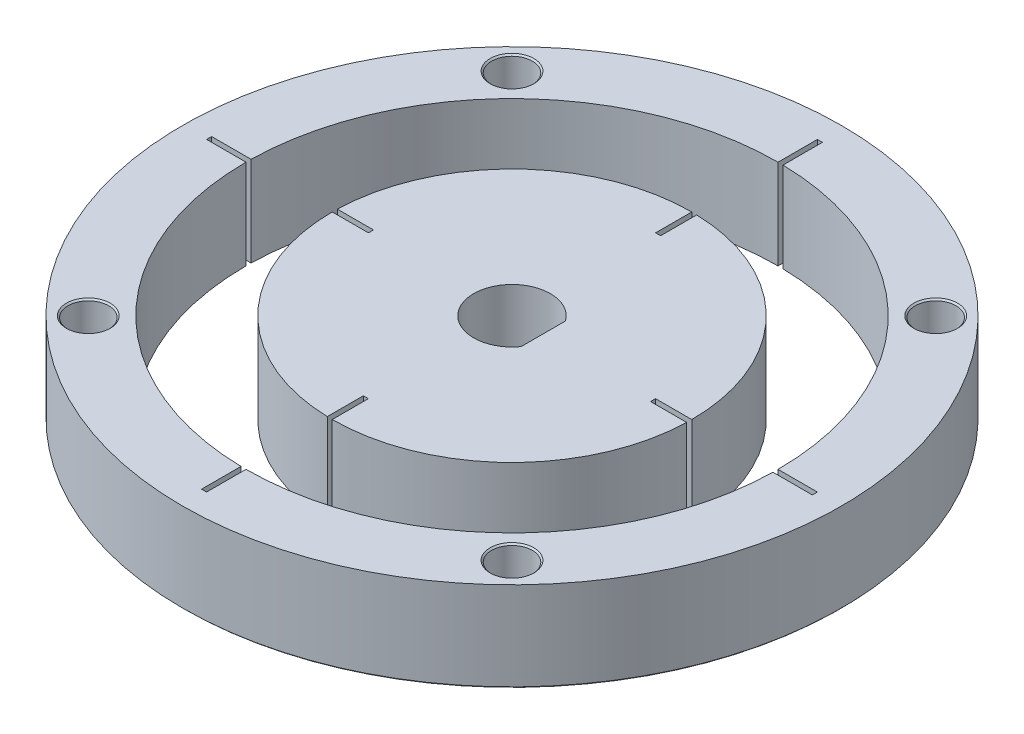
from build123d import *

# Parameters (mm, degrees)
SKETCH2_R             = 27.5
SKETCH2_R_2           = 22.197520882
BOSS_EXTRUDE3_DEPTH   = 7.5
BOSS_EXTRUDE3_2_DEPTH = 7.5
SKETCH5_R             = 1.7
SKETCH5_W             = 0.42
SKETCH5_H             = 13.5
SKETCH5_W_2           = 13.5
SKETCH5_H_2           = 0.42
CUT_EXTRUDE6_DEPTH    = 40.607448794
CUT_EXTRUDE8_DEPTH    = 7.5
CHAMFER3_SIZE         = 0.125
CHAMFER4_SIZE         = 0.125


with BuildPart() as part:
    # Sketch2 → Boss-Extrude3 (new body)
    with BuildSketch(Plane(origin=(0, 0, 0), x_dir=(1, 0, 0), z_dir=(0, 1, 0))):
        with Locations(Location((0, 0, 0), (0, 0, 270))):
            Circle(SKETCH2_R)
        with Locations(Location((0, 0, 0), (0, 0, 270))):
            Circle(SKETCH2_R_2, mode=Mode.SUBTRACT)
    extrude(amount=BOSS_EXTRUDE3_DEPTH)

    # Sketch5 → Cut-Extrude6 (cut, through all)
    with BuildSketch(Plane.XZ):
        with Locations(Location((-17.67766953, 17.67766953, 0), (0, 0, 270))):
            Circle(SKETCH5_R)
        with Locations(Location((17.67766953, 17.67766953, 0), (0, 0, 270))):
            Circle(SKETCH5_R)
        with Locations(Location((17.67766953, -17.67766953, 0), (0, 0, 270))):
            Circle(SKETCH5_R)
        with Locations(Location((-17.67766953, -17.67766953, 0), (0, 0, 270))):
            Circle(SKETCH5_R)
        with Locations((0.21, -18.733167206)):
            Rectangle(SKETCH5_W, SKETCH5_H)
        with Locations((-18.733167206, -0.21)):
            Rectangle(SKETCH5_W_2, SKETCH5_H_2)
        with Locations((-0.21, 18.733167206)):
            Rectangle(SKETCH5_W, SKETCH5_H)
        with Locations((18.733167206, 0.21)):
            Rectangle(SKETCH5_W_2, SKETCH5_H_2)
    extrude(amount=-CUT_EXTRUDE6_DEPTH, mode=Mode.SUBTRACT)

    # Chamfer4
    chamfer4_edges = [part.edges().sort_by_distance(p)[0] for p in [
        (0, 0, -27.5),
        (-17.67766953, 7.5, 19.37766953),
        (-17.67766953, 0, 19.37766953),
        (17.67766953, 7.5, 19.37766953),
        (17.67766953, 0, 19.37766953),
        (17.67766953, 7.5, -15.97766953),
        (17.67766953, 0, -15.97766953),
        (-17.67766953, 7.5, -15.97766953),
        (-17.67766953, 0, -15.97766953),
    ]]
    chamfer(chamfer4_edges, length=CHAMFER4_SIZE)


with BuildPart() as body_2:
    # Sketch2 → Boss-Extrude3 2 (new body)
    with BuildSketch(Plane(origin=(0, 0, 0), x_dir=(1, 0, 0), z_dir=(0, 1, 0))):
        with BuildLine():
            Line((0, -15), (0, -11.983167206))
            Line((0, -11.983167206), (-0.42, -11.983167206))
            Line((-0.42, -11.983167206), (-0.42, -14.994118847))
            ThreePointArc((-0.42, -14.994118847), (-10.754068997, -10.457055035), (-15, 0))
            Line((-15, 0), (-11.983167206, 0))
            Line((-11.983167206, 0), (-11.983167206, 0.42))
            Line((-11.983167206, 0.42), (-14.994118847, 0.42))
            ThreePointArc((-14.994118847, 0.42), (-10.457055035, 10.754068997), (0, 15))
            Line((0, 15), (0, 11.983167206))
            Line((0, 11.983167206), (0.42, 11.983167206))
            Line((0.42, 11.983167206), (0.42, 14.994118847))
            ThreePointArc((0.42, 14.994118847), (10.754068997, 10.457055035), (15, 0))
            Line((15, 0), (11.983167206, 0))
            Line((11.983167206, 0), (11.983167206, -0.42))
            Line((11.983167206, -0.42), (14.994118847, -0.42))
            ThreePointArc((14.994118847, -0.42), (10.457055035, -10.754068997), (0, -15))
        make_face()
    extrude(amount=BOSS_EXTRUDE3_2_DEPTH)

    # Sketch7 → Cut-Extrude8 (cut)
    with BuildSketch(Plane.XZ):
        with BuildLine():
            Line((2.611025673, 1.850012144), (2.611025673, -1.850012144))
            ThreePointArc((2.611025673, -1.850012144), (-3.2, 0), (2.611025673, 1.850012144))
        make_face()
    extrude(amount=-CUT_EXTRUDE8_DEPTH, mode=Mode.SUBTRACT)

    # Chamfer3
    chamfer3_edges = [body_2.edges().sort_by_distance(p)[0] for p in [
        (2.611025673, 0, 0),
        (-3.2, 0, 0),
    ]]
    chamfer(chamfer3_edges, length=CHAMFER3_SIZE)


solid = Compound([part.part, body_2.part])
